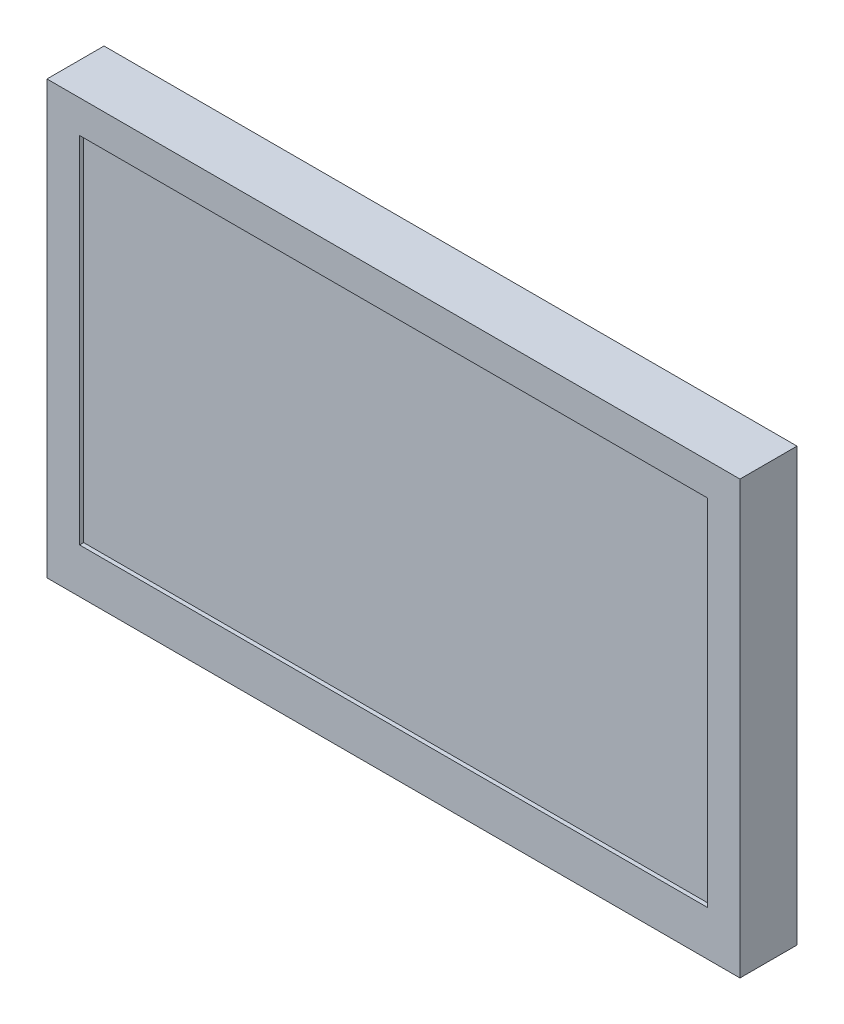
from build123d import *

# Parameters (mm, degrees)
SKETCH_1_W          = 170
SKETCH_1_H          = 106
EXTRUDE_1_DEPTH     = 14
SKETCH_2_R          = 2
CUT_EXTRUDE_1_DEPTH = 5
SKETCH_3_W          = 154
SKETCH_3_H          = 87
CUT_EXTRUDE_2_DEPTH = 1


with BuildPart() as part:
    # 草图1 → 凸台-拉伸1 (new body)
    with BuildSketch(Plane.XY):
        Rectangle(SKETCH_1_W, SKETCH_1_H)
    extrude(amount=-EXTRUDE_1_DEPTH)

    # 草图2 → 切除-拉伸1 (cut)
    with BuildSketch(Plane(origin=(0, 0, -14), x_dir=(-1, 0, 0), z_dir=(0, 0, -1))):
        with Locations((37.5, 37.5)):
            Circle(SKETCH_2_R)
        with Locations((-37.5, 37.5)):
            Circle(SKETCH_2_R)
        with Locations((-37.5, -37.5)):
            Circle(SKETCH_2_R)
        with Locations((37.5, -37.5)):
            Circle(SKETCH_2_R)
    extrude(amount=-CUT_EXTRUDE_1_DEPTH, mode=Mode.SUBTRACT)

    # 草图3 → 切除-拉伸2 (cut)
    with BuildSketch(Plane.XY):
        with Locations((0, 1.5)):
            Rectangle(SKETCH_3_W, SKETCH_3_H)
    extrude(amount=-CUT_EXTRUDE_2_DEPTH, mode=Mode.SUBTRACT)


solid = part.part
